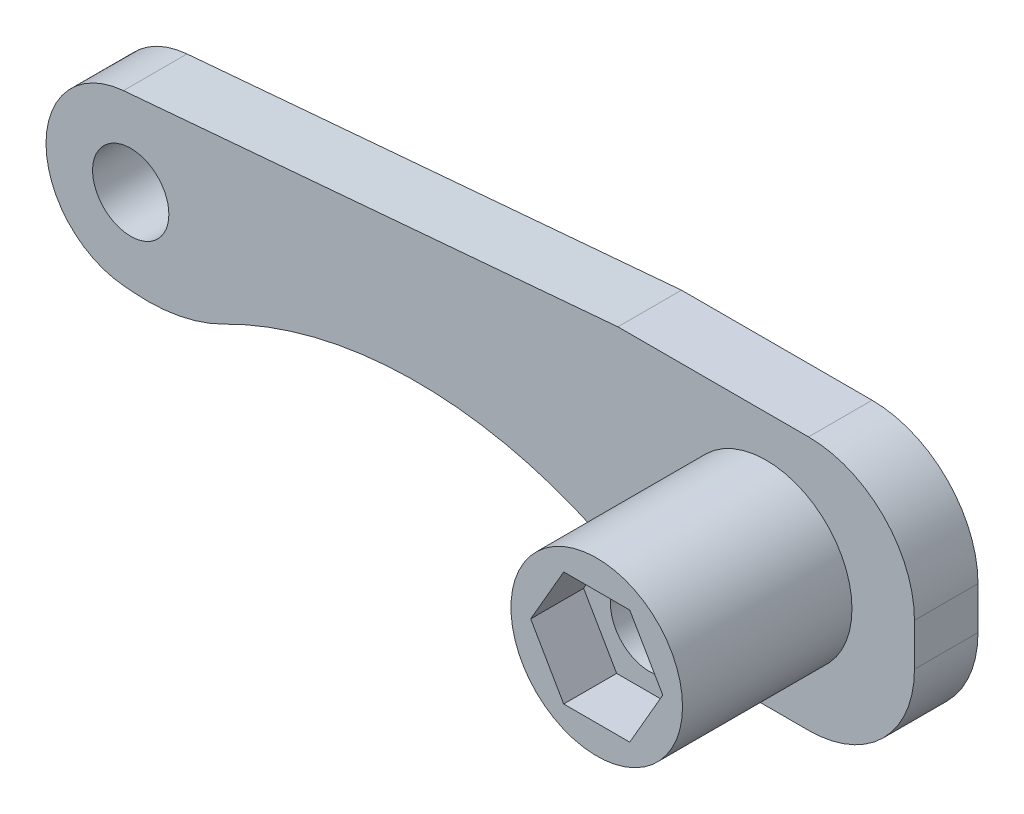
from build123d import *

# Parameters (mm, degrees)
SKETCH1_R               = 4.05
SKETCH1_R_2             = 1.8
BOSS_EXTRUDE1_DEPTH     = 3
SKETCH1_2_R             = 4.05
BOSS_EXTRUDE2_DEPTH     = 11
FILLET1_R               = 5
SKETCH2_R               = 1.85
CUT_EXTRUDE1_DEPTH      = 37.235341864
CUT_EXTRUDE2_DEPTH      = 2.5
CUT_EXTRUDE3_DEPTH      = 36.440090293
CUT_EXTRUDE3_DEPTH_BACK = 36.440090293
FILLET2_R               = 8


with BuildPart() as part:
    # Sketch1 → Boss-Extrude1 (new body)
    with BuildSketch(Plane.XY):
        with BuildLine():
            Line((-7, 6), (-30.343961021, 3.985183912))
            ThreePointArc((-30.343961021, 3.985183912), (-34, 0), (-30.343961021, -3.985183912))
            Line((-30.343961021, -3.985183912), (-7, -6))
            Line((-7, -6), (7, -6))
            Line((7, -6), (7, 6))
            Line((7, 6), (-7, 6))
        make_face()
        Circle(SKETCH1_R, mode=Mode.SUBTRACT)
        with Locations((-30, 0)):
            Circle(SKETCH1_R_2, mode=Mode.SUBTRACT)
    extrude(amount=BOSS_EXTRUDE1_DEPTH)

    # Sketch1<2> → Boss-Extrude2 (add)
    with BuildSketch(Plane.XY):
        Circle(SKETCH1_2_R)
    extrude(amount=BOSS_EXTRUDE2_DEPTH)

    # Fillet1
    fillet1_edges = [part.edges().sort_by_distance(p)[0] for p in [
        (7, 6, 1.5),
        (7, -6, 1.5),
    ]]
    fillet(fillet1_edges, radius=FILLET1_R)

    # Sketch2 → Cut-Extrude1 (cut, through all)
    with BuildSketch(Plane(origin=(0, 0, 0), x_dir=(-1, 0, 0), z_dir=(0, 0, -1))):
        Circle(SKETCH2_R)
    extrude(amount=-CUT_EXTRUDE1_DEPTH, mode=Mode.SUBTRACT)

    # Sketch3 → Cut-Extrude2 (cut)
    with BuildSketch(Plane.XY.offset(11)):
        Polygon((1.558845727, 2.7), (-1.558845727, 2.7), (-3.117691454, 0), (-1.558845727, -2.7), (1.558845727, -2.7), (3.117691454, 0), align=None)
    extrude(amount=-CUT_EXTRUDE2_DEPTH, mode=Mode.SUBTRACT)

    # Sketch5 → Cut-Extrude3 (cut, two sides: drawn at the far end of the back side and taken through both)
    with BuildSketch(Plane.XY.offset(3).offset(-CUT_EXTRUDE3_DEPTH_BACK)):
        with BuildLine():
            Line((-27.410855082, -4.238340137), (-7, -6))
            Line((-7, -6), (-3.277962863, -6))
            Line((-3.277962863, -6), (-3.271243445, -6))
            ThreePointArc((-3.271243445, -6), (-15.044311785, -1.053046052), (-27.410855082, -4.238340137))
        make_face()
    extrude(amount=CUT_EXTRUDE3_DEPTH + CUT_EXTRUDE3_DEPTH_BACK, mode=Mode.SUBTRACT)

    # Fillet2
    fillet2_edges = [part.edges().sort_by_distance(p)[0] for p in [
        (-27.410855082, -4.238340137, 1.5),
        (-3.271243445, -6, 1.5),
    ]]
    fillet(fillet2_edges, radius=FILLET2_R)


solid = part.part
